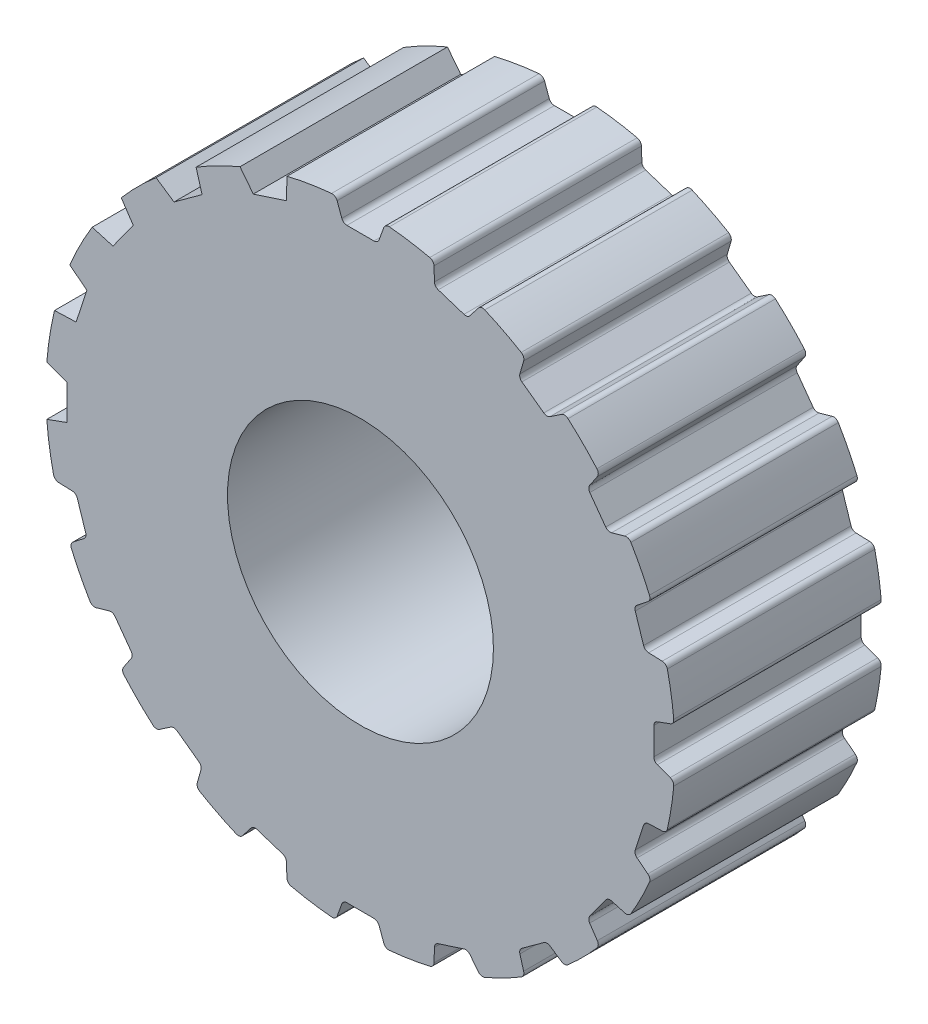
from build123d import *

# Parameters (mm, degrees)
BOSS_EXTRUDE1_DEPTH      = 7.25
BOSS_EXTRUDE1_DEPTH_BACK = 7.25
SKETCH7_R                = 29.575653678
CUT_EXTRUDE3_DEPTH       = 48.028593228
CUT_EXTRUDE3_DEPTH_BACK  = 48.028593228
SKETCH15_R               = 8.008120878
SKETCH15_R_2             = 2.25
BOSS_EXTRUDE2_DEPTH      = 5.5
SKETCH16_R               = 5
CUT_EXTRUDE4_DEPTH       = 3
BOSS_EXTRUDE3_START      = 7.5
SKETCH17_R               = 29.575653678
SKETCH17_R_2             = 5
BOSS_EXTRUDE3_DEPTH      = 7.5
CUT_EXTRUDE2_DEPTH       = 48.028593228
CUT_EXTRUDE2_DEPTH_BACK  = 48.028593228
FILLET2_R                = 0.51
BOSS_EXTRUDE4_START      = 2.5
SKETCH18_R               = 34.575653678
SKETCH18_R_2             = 5
BOSS_EXTRUDE4_DEPTH      = 2.5
BOSS_EXTRUDE5_START      = -2.5
SKETCH19_R               = 34.575653678
SKETCH19_R_2             = 19
BOSS_EXTRUDE5_DEPTH      = 2.5
FILLET3_R                = 0.5
CUT_EXTRUDE5_DEPTH       = 54.41536919
CUT_EXTRUDE5_DEPTH_BACK  = 54.41536919
SKETCH20_W               = 16.75
SKETCH20_H               = 69.151307356
SKETCH20_W_2             = 2.5
CUT_EXTRUDE6_DEPTH       = 45.207890454
CUT_EXTRUDE6_DEPTH_BACK  = 45.207890454
SKETCH21_R               = 12.5


with BuildPart() as part:
    # Sketch7 → Boss-Extrude1 (new, two sides: drawn at the far end of the back side and taken through both)
    with BuildSketch(Plane.XY.offset(-BOSS_EXTRUDE1_DEPTH_BACK)):
        Circle(SKETCH7_R)
    extrude(amount=BOSS_EXTRUDE1_DEPTH + BOSS_EXTRUDE1_DEPTH_BACK)

    # Sketch14 → Revolve1 (revolve)
    with BuildSketch(Plane(origin=(0, 0, 0), x_dir=(0, 0, -1), z_dir=(1, 0, 0))):
        with BuildLine():
            Line((-21.5, 0), (0, 0))
            Line((0, 0), (0, 19))
            Line((0, 19), (-7.25, 19))
            ThreePointArc((-7.25, 19), (-13.040017522, 12.386277742), (-21.5, 10))
            Line((-21.5, 10), (-21.5, 0))
        make_face()
    revolve(axis=Axis((0, 0, -36.129595921), (0, 0, 1)))

    # Sketch10 → Cut-Extrude3 (cut, two sides: drawn at the far end of the back side and taken through both)
    with BuildSketch(Plane.XY.offset(-CUT_EXTRUDE3_DEPTH_BACK)):
        with BuildLine():
            Line((2.2, 7.7), (-2.2, 7.7))
            Line((-2.2, 7.7), (-2.2, 5.796550698))
            ThreePointArc((-2.2, 5.796550698), (0, -6.2), (2.2, 5.796550698))
            Line((2.2, 5.796550698), (2.2, 7.7))
        make_face()
    extrude(amount=CUT_EXTRUDE3_DEPTH + CUT_EXTRUDE3_DEPTH_BACK, mode=Mode.SUBTRACT)

    # Sketch15 → Boss-Extrude2 (add)
    with BuildSketch(Plane(origin=(0, 0, -7.25), x_dir=(-1, 0, 0), z_dir=(0, 0, -1))):
        Circle(SKETCH15_R)
        Circle(SKETCH15_R_2, mode=Mode.SUBTRACT)
    extrude(amount=-BOSS_EXTRUDE2_DEPTH)

    # Sketch16 → Cut-Extrude4 (cut)
    with BuildSketch(Plane(origin=(0, 0, -7.25), x_dir=(-1, 0, 0), z_dir=(0, 0, -1))):
        Circle(SKETCH16_R)
    extrude(amount=-CUT_EXTRUDE4_DEPTH, mode=Mode.SUBTRACT)

    # Sketch17 → Boss-Extrude3 (add)
    with BuildSketch(Plane(origin=(0, 0, -7.25), x_dir=(-1, 0, 0), z_dir=(0, 0, -1)).offset(BOSS_EXTRUDE3_START)):
        Circle(SKETCH17_R)
        Circle(SKETCH17_R_2, mode=Mode.SUBTRACT)
    extrude(amount=-BOSS_EXTRUDE3_DEPTH)

    # Sketch8 → Cut-Extrude2 (cut, two sides: drawn at the far end of the back side and taken through both)
    with BuildSketch(Plane.XY.offset(-CUT_EXTRUDE2_DEPTH_BACK)):
        Polygon((-1.629816853, 27.574125652), (-2.358313477, 29.575653678), (2.358313477, 29.575653678), (1.629816853, 27.574125652), align=None)
        Polygon((6.970825494, 26.728192988), (6.896490207, 28.856877097), (11.382269006, 27.399359212), (10.07092137, 25.720910778), align=None)
        Polygon((14.889114872, 23.265918568), (15.476217378, 25.313388327), (19.29204874, 22.541024563), (17.526213935, 21.349953948), align=None)
        Polygon((21.349953948, 17.526213935), (22.541024563, 19.29204874), (25.313388327, 15.476217378), (23.265918568, 14.889114872), align=None)
        Polygon((25.720910778, 10.07092137), (27.399359212, 11.382269006), (28.856877097, 6.896490207), (26.728192988, 6.970825494), align=None)
        Polygon((27.574125652, 1.629816853), (29.575653678, 2.358313477), (29.575653678, -2.358313477), (27.574125652, -1.629816853), align=None)
        Polygon((26.728192988, -6.970825494), (28.856877097, -6.896490207), (27.399359212, -11.382269006), (25.720910778, -10.07092137), align=None)
        Polygon((23.265918568, -14.889114872), (25.313388327, -15.476217378), (22.541024563, -19.29204874), (21.349953948, -17.526213935), align=None)
        Polygon((17.526213935, -21.349953948), (19.29204874, -22.541024563), (15.476217378, -25.313388327), (14.889114872, -23.265918568), align=None)
        Polygon((10.07092137, -25.720910778), (11.382269006, -27.399359212), (6.896490207, -28.856877097), (6.970825494, -26.728192988), align=None)
        Polygon((1.629816853, -27.574125652), (2.358313477, -29.575653678), (-2.358313477, -29.575653678), (-1.629816853, -27.574125652), align=None)
        Polygon((-6.970825494, -26.728192988), (-6.896490207, -28.856877097), (-11.382269006, -27.399359212), (-10.07092137, -25.720910778), align=None)
        Polygon((-14.889114872, -23.265918568), (-15.476217378, -25.313388327), (-19.29204874, -22.541024563), (-17.526213935, -21.349953948), align=None)
        Polygon((-21.349953948, -17.526213935), (-22.541024563, -19.29204874), (-25.313388327, -15.476217378), (-23.265918568, -14.889114872), align=None)
        Polygon((-25.720910778, -10.07092137), (-27.399359212, -11.382269006), (-28.856877097, -6.896490207), (-26.728192988, -6.970825494), align=None)
        Polygon((-27.574125652, -1.629816853), (-29.575653678, -2.358313477), (-29.575653678, 2.358313477), (-27.574125652, 1.629816853), align=None)
        Polygon((-26.728192988, 6.970825494), (-28.856877097, 6.896490207), (-27.399359212, 11.382269006), (-25.720910778, 10.07092137), align=None)
        Polygon((-23.265918568, 14.889114872), (-25.313388327, 15.476217378), (-22.541024563, 19.29204874), (-21.349953948, 17.526213935), align=None)
        Polygon((-17.526213935, 21.349953948), (-19.29204874, 22.541024563), (-15.476217378, 25.313388327), (-14.889114872, 23.265918568), align=None)
        Polygon((-10.07092137, 25.720910778), (-11.382269006, 27.399359212), (-6.896490207, 28.856877097), (-6.970825494, 26.728192988), align=None)
    extrude(amount=CUT_EXTRUDE2_DEPTH + CUT_EXTRUDE2_DEPTH_BACK, mode=Mode.SUBTRACT)

    # Fillet2
    fillet2_edges = [part.edges().sort_by_distance(p)[0] for p in [
        (-28.759534341, -6.89988949, -3.75),
        (-27.322605317, -11.322302291, -3.75),
        (-25.219759429, -15.449369723, -3.75),
        (-22.486558005, -19.211298747, -3.75),
        (-19.211298747, -22.486558005, -3.75),
        (-15.449369723, -25.219759429, -3.75),
        (-11.322302291, -27.322605317, -3.75),
        (-6.89988949, -28.759534341, -3.75),
        (-2.325, -29.484125652, -3.75),
        (2.325, -29.484125652, -3.75),
        (6.89988949, -28.759534341, -3.75),
        (11.322302291, -27.322605317, -3.75),
        (15.449369723, -25.219759429, -3.75),
        (19.211298747, -22.486558005, -3.75),
        (22.486558005, -19.211298747, -3.75),
        (25.219759429, -15.449369723, -3.75),
        (27.322605317, -11.322302291, -3.75),
        (28.759534341, -6.89988949, -3.75),
        (29.484125652, -2.325, -3.75),
        (29.484125652, 2.325, -3.75),
        (28.759534341, 6.89988949, -3.75),
        (27.322605317, 11.322302291, -3.75),
        (25.219759429, 15.449369723, -3.75),
        (22.486558005, 19.211298747, -3.75),
        (19.211298747, 22.486558005, -3.75),
        (15.449369723, 25.219759429, -3.75),
        (11.322302291, 27.322605317, -3.75),
        (6.89988949, 28.759534341, -3.75),
        (2.325, 29.484125652, -3.75),
        (-26.728192988, -6.970825494, -3.75),
        (-25.720910778, -10.07092137, -3.75),
        (-23.265918568, -14.889114872, -3.75),
        (-21.349953948, -17.526213935, -3.75),
        (-17.526213935, -21.349953948, -3.75),
        (-14.889114872, -23.265918568, -3.75),
        (-10.07092137, -25.720910778, -3.75),
        (-6.970825494, -26.728192988, -3.75),
        (-1.629816853, -27.574125652, -3.75),
        (1.629816853, -27.574125652, -3.75),
        (6.970825494, -26.728192988, -3.75),
        (10.07092137, -25.720910778, -3.75),
        (14.889114872, -23.265918568, -3.75),
        (17.526213935, -21.349953948, -3.75),
        (21.349953948, -17.526213935, -3.75),
        (23.265918568, -14.889114872, -3.75),
        (25.720910778, -10.07092137, -3.75),
        (26.728192988, -6.970825494, -3.75),
        (27.574125652, -1.629816853, -3.75),
        (27.574125652, 1.629816853, -3.75),
        (26.728192988, 6.970825494, -3.75),
        (25.720910778, 10.07092137, -3.75),
        (23.265918568, 14.889114872, -3.75),
        (21.349953948, 17.526213935, -3.75),
        (17.526213935, 21.349953948, -3.75),
        (14.889114872, 23.265918568, -3.75),
        (10.07092137, 25.720910778, -3.75),
        (6.970825494, 26.728192988, -3.75),
        (1.629816853, 27.574125652, -3.75),
        (-1.629816853, 27.574125652, -3.75),
        (-2.325, 29.484125652, -3.75),
    ]]
    fillet(fillet2_edges, radius=FILLET2_R)

    # Sketch18 → Boss-Extrude4 (add)
    with BuildSketch(Plane(origin=(0, 0, -14.75), x_dir=(-1, 0, 0), z_dir=(0, 0, -1)).offset(BOSS_EXTRUDE4_START)):
        Circle(SKETCH18_R)
        Circle(SKETCH18_R_2, mode=Mode.SUBTRACT)
    extrude(amount=-BOSS_EXTRUDE4_DEPTH)

    # Sketch19 → Boss-Extrude5 (add)
    with BuildSketch(Plane.XY.offset(7.25).offset(BOSS_EXTRUDE5_START)):
        Circle(SKETCH19_R)
        Circle(SKETCH19_R_2, mode=Mode.SUBTRACT)
    extrude(amount=BOSS_EXTRUDE5_DEPTH)

    # Fillet3
    fillet3_edges = [part.edges().sort_by_distance(p)[0] for p in [
        (2.2, 5.796550698, 9.875),
        (-2.2, 5.796550698, 9.875),
        (2.2, 6.748275349, 21.5),
        (-2.2, 6.748275349, 21.5),
        (0, 7.7, 21.5),
        (0, -19, 7.25),
        (0, -10, 21.5),
        (0, -6.2, 21.5),
        (5, 0, -4.25),
        (2.25, 0, -4.25),
        (-2.2, 6.748275349, -1.75),
        (2.2, 6.748275349, -1.75),
        (-34.575653678, 0, 4.75),
        (34.575653678, 0, -14.75),
        (34.575653678, 0, -17.25),
        (-34.575653678, 0, 7.25),
        (0, 7.7, -1.75),
        (0, -6.2, -1.75),
        (5, 0, -17.25),
    ]]
    fillet(fillet3_edges, radius=FILLET3_R)

    # Sketch20 → Cut-Extrude5 (cut, two sides: drawn at the far end of the back side and taken through both)
    with BuildSketch(Plane(origin=(0, 0, 0), x_dir=(0, 0, -1), z_dir=(1, 0, 0)).offset(-CUT_EXTRUDE5_DEPTH_BACK)):
        with Locations((-13.125, 0)):
            Rectangle(SKETCH20_W, SKETCH20_H)
        with Locations((16, 0)):
            Rectangle(SKETCH20_W_2, SKETCH20_H)
    extrude(amount=CUT_EXTRUDE5_DEPTH + CUT_EXTRUDE5_DEPTH_BACK, mode=Mode.SUBTRACT)

    # Sketch21 → Cut-Extrude6 (cut, two sides: drawn at the far end of the back side and taken through both)
    with BuildSketch(Plane.XY.offset(-CUT_EXTRUDE6_DEPTH_BACK)):
        Circle(SKETCH21_R)
    extrude(amount=CUT_EXTRUDE6_DEPTH + CUT_EXTRUDE6_DEPTH_BACK, mode=Mode.SUBTRACT)


solid = part.part
